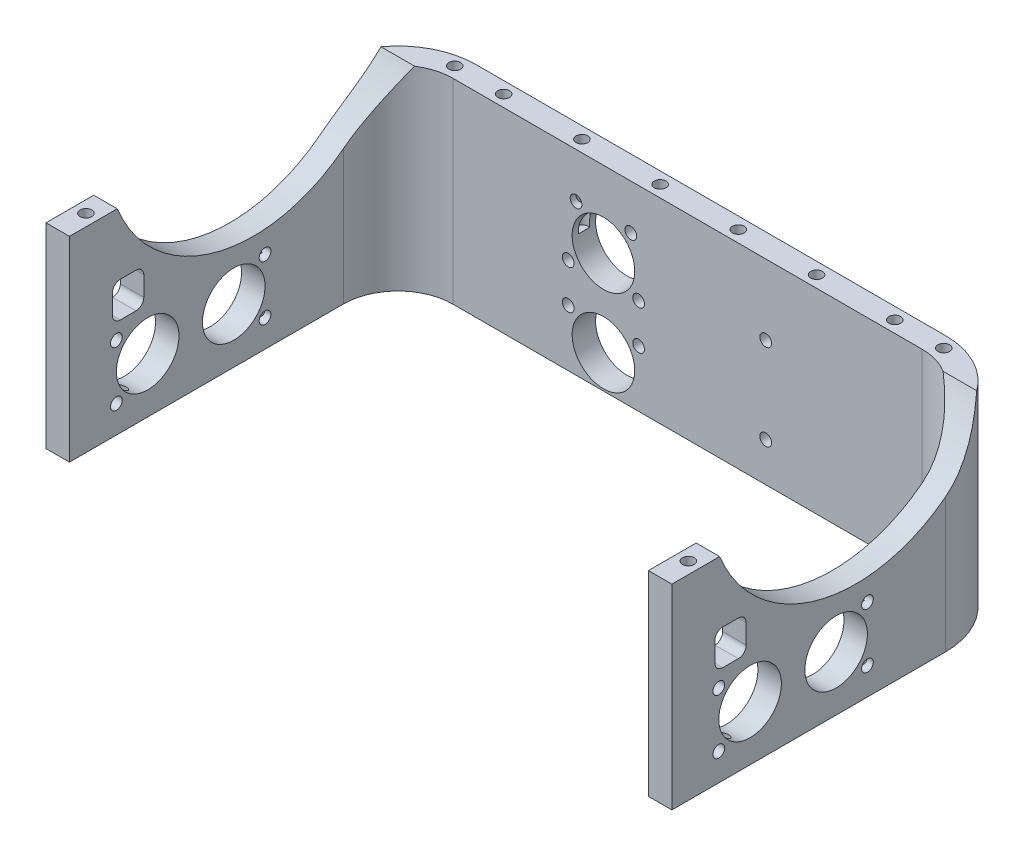
from build123d import *

# Parameters (mm, degrees)
SALIENTE_EXTRUIR1_DEPTH = 50
CROQUIS2_R              = 8
CROQUIS2_R_2            = 1.5
CORTAR_EXTRUIR1_DEPTH   = 173
CROQUIS3_R              = 37.5
CORTAR_EXTRUIR2_DEPTH   = 180
CROQUIS4_R              = 8
CROQUIS4_R_2            = 1.5
CORTAR_EXTRUIR3_DEPTH   = 10
CROQUIS5_R              = 1.5
CORTAR_EXTRUIR4_DEPTH   = 20
CORTAR_EXTRUIR5_START   = -20
CROQUIS6_R              = 1.5
CORTAR_EXTRUIR5_DEPTH   = 20
CORTAR_EXTRUIR6_DEPTH   = 210


with BuildPart() as part:
    # Croquis1 → Saliente-Extruir1 (new body)
    with BuildSketch(Plane(origin=(0, 0, 0), x_dir=(1, 0, 0), z_dir=(0, 1, 0))):
        with BuildLine():
            Line((-20, -6), (-140, -6))
            ThreePointArc((-140, -6), (-149.899494937, -10.100505063), (-154, -20))
            Line((-154, -20), (-154, -84))
            Line((-154, -84), (-154, -90))
            Line((-154, -90), (-160, -90))
            Line((-160, -90), (-160, -20))
            ThreePointArc((-160, -20), (-154.142135624, -5.857864376), (-140, 0))
            Line((-140, 0), (-20, 0))
            ThreePointArc((-20, 0), (-5.857864376, -5.857864376), (0, -20))
            Line((0, -20), (0, -90))
            Line((0, -90), (-6, -90))
            Line((-6, -90), (-6, -84))
            Line((-6, -84), (-6, -20))
            ThreePointArc((-6, -20), (-10.100505063, -10.100505063), (-20, -6))
        make_face()
    extrude(amount=SALIENTE_EXTRUIR1_DEPTH)

    # Croquis2 → Cortar-Extruir1 (cut)
    with BuildSketch(Plane.ZY.offset(160)):
        with Locations((70, 14)):
            Circle(CROQUIS2_R)
        with Locations((48, 14)):
            Circle(CROQUIS2_R)
        with Locations((40, 21)):
            Circle(CROQUIS2_R_2)
        with Locations((40, 7)):
            Circle(CROQUIS2_R_2)
        with Locations((78, 21)):
            Circle(CROQUIS2_R_2)
        with Locations((78, 7)):
            Circle(CROQUIS2_R_2)
    extrude(amount=-CORTAR_EXTRUIR1_DEPTH, mode=Mode.SUBTRACT)

    # Croquis3 → Cortar-Extruir2 (cut)
    with BuildSketch(Plane(origin=(0, 0, 0), x_dir=(0, 0, -1), z_dir=(1, 0, 0))):
        with Locations((-43, 64)):
            Circle(CROQUIS3_R)
    extrude(amount=-CORTAR_EXTRUIR2_DEPTH, mode=Mode.SUBTRACT)

    # Croquis4 → Cortar-Extruir3 (cut)
    with BuildSketch(Plane(origin=(0, 0, 0), x_dir=(-1, 0, 0), z_dir=(0, 0, -1))):
        with Locations((101.5, 8.5)):
            Circle(CROQUIS4_R)
        with Locations((101.5, 30.5)):
            Circle(CROQUIS4_R)
        with Locations((92.5, 24.5)):
            Circle(CROQUIS4_R_2)
        with Locations((92.5, 14.5)):
            Circle(CROQUIS4_R_2)
        with Locations((110.5, 24.5)):
            Circle(CROQUIS4_R_2)
        with Locations((110.5, 14.5)):
            Circle(CROQUIS4_R_2)
        with Locations((108.5, 38.5)):
            Circle(CROQUIS4_R_2)
        with Locations((94.5, 38.5)):
            Circle(CROQUIS4_R_2)
        with Locations((60, 32)):
            Circle(CROQUIS4_R_2)
        with Locations((60, 10)):
            Circle(CROQUIS4_R_2)
    extrude(amount=-CORTAR_EXTRUIR3_DEPTH, mode=Mode.SUBTRACT)

    # Croquis5 → Cortar-Extruir4 (cut)
    with BuildSketch(Plane(origin=(0, 50, 0), x_dir=(1, 0, 0), z_dir=(0, 1, 0))):
        with Locations(Location((-90, -3, 0), (0, 0, 270))):
            Circle(CROQUIS5_R)
        with Locations(Location((-110, -3, 0), (0, 0, 270))):
            Circle(CROQUIS5_R)
        with Locations(Location((-130, -3, 0), (0, 0, 270))):
            Circle(CROQUIS5_R)
        with Locations(Location((-70, -3, 0), (0, 0, 270))):
            Circle(CROQUIS5_R)
        with Locations(Location((-50, -3, 0), (0, 0, 270))):
            Circle(CROQUIS5_R)
        with Locations(Location((-30, -3, 0), (0, 0, 270))):
            Circle(CROQUIS5_R)
        with Locations(Location((-157, -82.788647574, 0), (0, 0, 270))):
            Circle(CROQUIS5_R)
        with Locations(Location((-3, -82.788647574, 0), (0, 0, 270))):
            Circle(CROQUIS5_R)
        with Locations(Location((-142.5, -3, 0), (0, 0, 270))):
            Circle(CROQUIS5_R)
        with Locations(Location((-17.5, -3, 0), (0, 0, 270))):
            Circle(CROQUIS5_R)
    extrude(amount=-CORTAR_EXTRUIR4_DEPTH, mode=Mode.SUBTRACT)

    # Croquis6 → Cortar-Extruir5 (cut)
    with BuildSketch(Plane(origin=(0, 0, 0), x_dir=(-1, 0, 0), z_dir=(0, -1, 0)).offset(CORTAR_EXTRUIR5_START)):
        with Locations(Location((88, -3, 0), (0, 0, 90))):
            Circle(CROQUIS6_R)
        with Locations(Location((115, -3, 0), (0, 0, 90))):
            Circle(CROQUIS6_R)
        with Locations(Location((130, -3, 0), (0, 0, 270))):
            Circle(CROQUIS6_R)
        with Locations(Location((72, -3, 0), (0, 0, 90))):
            Circle(CROQUIS6_R)
        with Locations(Location((45, -3, 0), (0, 0, 90))):
            Circle(CROQUIS6_R)
        with Locations(Location((30, -3, 0), (0, 0, 270))):
            Circle(CROQUIS6_R)
        with Locations(Location((157, -38, 0), (0, 0, 90))):
            Circle(CROQUIS6_R)
        with Locations(Location((157, -74, 0), (0, 0, 90))):
            Circle(CROQUIS6_R)
        with Locations(Location((3, -74, 0), (0, 0, 90))):
            Circle(CROQUIS6_R)
        with Locations(Location((3, -38, 0), (0, 0, 90))):
            Circle(CROQUIS6_R)
    extrude(amount=CORTAR_EXTRUIR5_DEPTH, mode=Mode.SUBTRACT)

    # Croquis7 → Cortar-Extruir6 (cut)
    with BuildSketch(Plane(origin=(0, 0, 0), x_dir=(0, 0, -1), z_dir=(1, 0, 0))):
        with BuildLine():
            Line((-73, 25), (-77, 25))
            ThreePointArc((-77, 25), (-78.414213562, 25.585786438), (-79, 27))
            Line((-79, 27), (-79, 32))
            ThreePointArc((-79, 32), (-78.414213562, 33.414213562), (-77, 34))
            Line((-77, 34), (-73, 34))
            ThreePointArc((-73, 34), (-71.585786438, 33.414213562), (-71, 32))
            Line((-71, 32), (-71, 27))
            ThreePointArc((-71, 27), (-71.585786438, 25.585786438), (-73, 25))
        make_face()
    extrude(amount=-CORTAR_EXTRUIR6_DEPTH, mode=Mode.SUBTRACT)


solid = part.part
